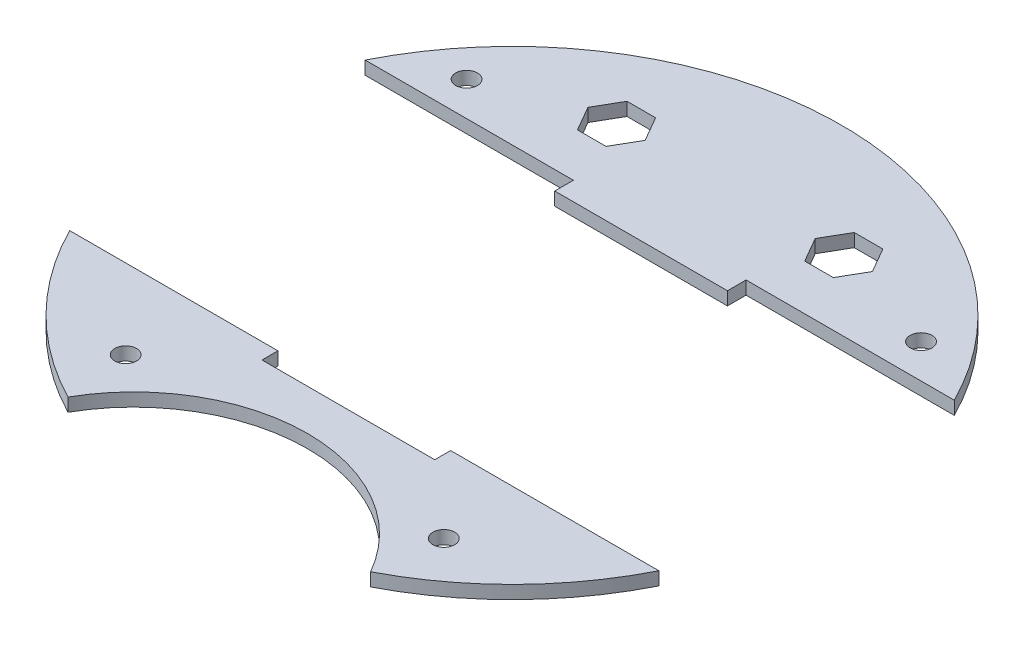
from build123d import *

# Parameters (mm, degrees)
BOSS_EXTRUDE1_DEPTH  = 2.9
SOLENOID_PLACEMENT_W = 38
SOLENOID_PLACEMENT_H = 64.4
CUT_EXTRUDE1_DEPTH   = 103.571487266
CUT_EXTRUDE5_DEPTH   = 103.571487266
SKETCH6_R            = 2.4
CUT_EXTRUDE6_DEPTH   = 103.571487266
CUT_EXTRUDE3_DEPTH   = 103.571487266


with BuildPart() as part:
    # Sketch1 → Boss-Extrude1 (new body)
    with BuildSketch(Plane(origin=(0, 0, 0), x_dir=(1, 0, 0), z_dir=(0, 1, 0))):
        with BuildLine():
            ThreePointArc((33.29110537, -64.404598464), (0, 72.5), (-33.29110537, -64.404598464))
            ThreePointArc((-33.29110537, -64.404598464), (0, -44.989799638), (33.29110537, -64.404598464))
        make_face()
    extrude(amount=BOSS_EXTRUDE1_DEPTH)

    # solenoid placement → Cut-Extrude1 (cut, through all)
    with BuildSketch(Plane(origin=(0, 2.9, 0), x_dir=(1, 0, 0), z_dir=(0, 1, 0))):
        with Locations((0, -3.8)):
            Rectangle(SOLENOID_PLACEMENT_W, SOLENOID_PLACEMENT_H)
    extrude(amount=-CUT_EXTRUDE1_DEPTH, mode=Mode.SUBTRACT)

    # Sketch5 → Cut-Extrude5 (cut, through all)
    with BuildSketch(Plane(origin=(0, 2.9, 0), x_dir=(1, 0, 0), z_dir=(0, 1, 0))):
        Polygon((-18.706882066, 48), (-21.853441033, 53.45), (-28.146558967, 53.45), (-31.293117934, 48), (-28.146558967, 42.55), (-21.853441033, 42.55), align=None)
        Polygon((18.706882066, 48), (21.853441033, 42.55), (28.146558967, 42.55), (31.293117934, 48), (28.146558967, 53.45), (21.853441033, 53.45), align=None)
    extrude(amount=-CUT_EXTRUDE5_DEPTH, mode=Mode.SUBTRACT)

    # Sketch6 → Cut-Extrude6 (cut, through all)
    with BuildSketch(Plane(origin=(0, 2.9, 0), x_dir=(1, 0, 0), z_dir=(0, 1, 0))):
        with Locations(Location((35, -50, 0), (0, 0, 270))):
            Circle(SKETCH6_R)
        with Locations(Location((-35, -50, 0), (0, 0, 270))):
            Circle(SKETCH6_R)
        with Locations(Location((-50, 40, 0), (0, 0, 270))):
            Circle(SKETCH6_R)
        with Locations(Location((50, 40, 0), (0, 0, 270))):
            Circle(SKETCH6_R)
    extrude(amount=-CUT_EXTRUDE6_DEPTH, mode=Mode.SUBTRACT)

    # Sketch3 → Cut-Extrude3 (cut, through all)
    with BuildSketch(Plane(origin=(0, 2.9, 0), x_dir=(1, 0, 0), z_dir=(0, 1, 0))):
        Polygon((-19, 28.4), (-19, 32.5), (-72.5, 32.5), (-72.5, -32.5), (72.5, -32.5), (72.5, 32.5), (19, 32.5), (19, 28.4), align=None)
    extrude(amount=-CUT_EXTRUDE3_DEPTH, mode=Mode.SUBTRACT)


with BuildPart() as cut_extrude3_piece_1:
    # of the separate pieces the step leaves, piece 1, a body of its own (cut_extrude3_pieces)
    add(part.part.solids().sort_by_distance((64.807406984, 0, -32.5))[0])


with BuildPart() as cut_extrude3_piece_2:
    # of the separate pieces the step leaves, piece 2, a body of its own (cut_extrude3_pieces)
    add(part.part.solids().sort_by_distance((-33.29110537, 0, 64.404598464))[0])


solid = Compound([cut_extrude3_piece_1.part, cut_extrude3_piece_2.part])
